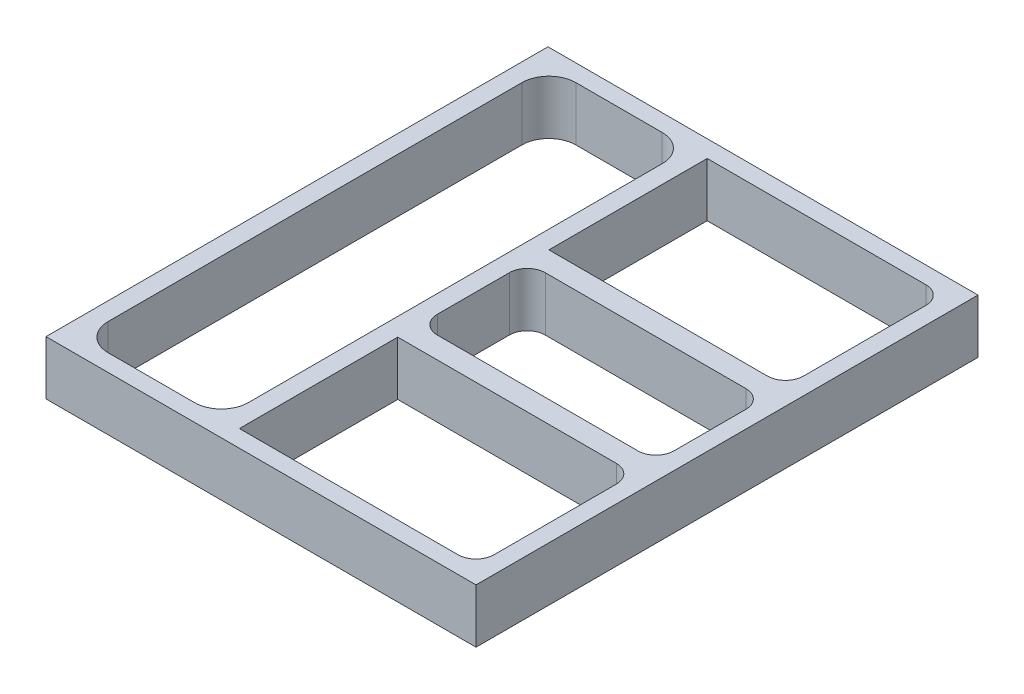
from build123d import *

# Parameters (mm, degrees)
SKETCH1_W           = 151.765
SKETCH1_H           = 177.165
BOSS_EXTRUDE1_DEPTH = 19.05


with BuildPart() as part:
    # Sketch1 → Boss-Extrude1 (new body)
    with BuildSketch(Plane(origin=(0, -0.635, 0), x_dir=(-1, 0, 0), z_dir=(0, -1, 0))):
        Rectangle(SKETCH1_W, SKETCH1_H)
        with BuildLine():
            Line((13.6525, 26.67), (13.6525, 82.55))
            Line((13.6525, 82.55), (-63.5, 82.55))
            ThreePointArc((-63.5, 82.55), (-67.990128061, 80.690128061), (-69.85, 76.2))
            Line((-69.85, 76.2), (-69.85, 33.02))
            ThreePointArc((-69.85, 33.02), (-67.990128061, 28.529871939), (-63.5, 26.67))
            Line((-63.5, 26.67), (13.6525, 26.67))
        make_face(mode=Mode.SUBTRACT)
        with BuildLine():
            Line((13.6525, -82.55), (13.6525, -26.67))
            Line((13.6525, -26.67), (-63.5, -26.67))
            ThreePointArc((-63.5, -26.67), (-67.990128061, -28.529871939), (-69.85, -33.02))
            Line((-69.85, -33.02), (-69.85, -76.2))
            ThreePointArc((-69.85, -76.2), (-67.990128061, -80.690128061), (-63.5, -82.55))
            Line((-63.5, -82.55), (13.6525, -82.55))
        make_face(mode=Mode.SUBTRACT)
        with BuildLine():
            Line((7.3025, -19.05), (-63.5, -19.05))
            ThreePointArc((-63.5, -19.05), (-67.990128061, -17.190128061), (-69.85, -12.7))
            Line((-69.85, -12.7), (-69.85, 12.7))
            ThreePointArc((-69.85, 12.7), (-67.990128061, 17.190128061), (-63.5, 19.05))
            Line((-63.5, 19.05), (7.3025, 19.05))
            ThreePointArc((7.3025, 19.05), (11.792628061, 17.190128061), (13.6525, 12.7))
            Line((13.6525, 12.7), (13.6525, -12.7))
            ThreePointArc((13.6525, -12.7), (11.792628061, -17.190128061), (7.3025, -19.05))
        make_face(mode=Mode.SUBTRACT)
        with BuildLine():
            Line((29.5275, -82.55), (60.0075, -82.55))
            ThreePointArc((60.0075, -82.55), (66.742692091, -79.760192091), (69.5325, -73.025))
            Line((69.5325, -73.025), (69.5325, 73.025))
            ThreePointArc((69.5325, 73.025), (66.742692091, 79.760192091), (60.0075, 82.55))
            Line((60.0075, 82.55), (29.5275, 82.55))
            ThreePointArc((29.5275, 82.55), (22.792307909, 79.760192091), (20.0025, 73.025))
            Line((20.0025, 73.025), (20.0025, -73.025))
            ThreePointArc((20.0025, -73.025), (22.792307909, -79.760192091), (29.5275, -82.55))
        make_face(mode=Mode.SUBTRACT)
    extrude(amount=BOSS_EXTRUDE1_DEPTH)


solid = part.part
